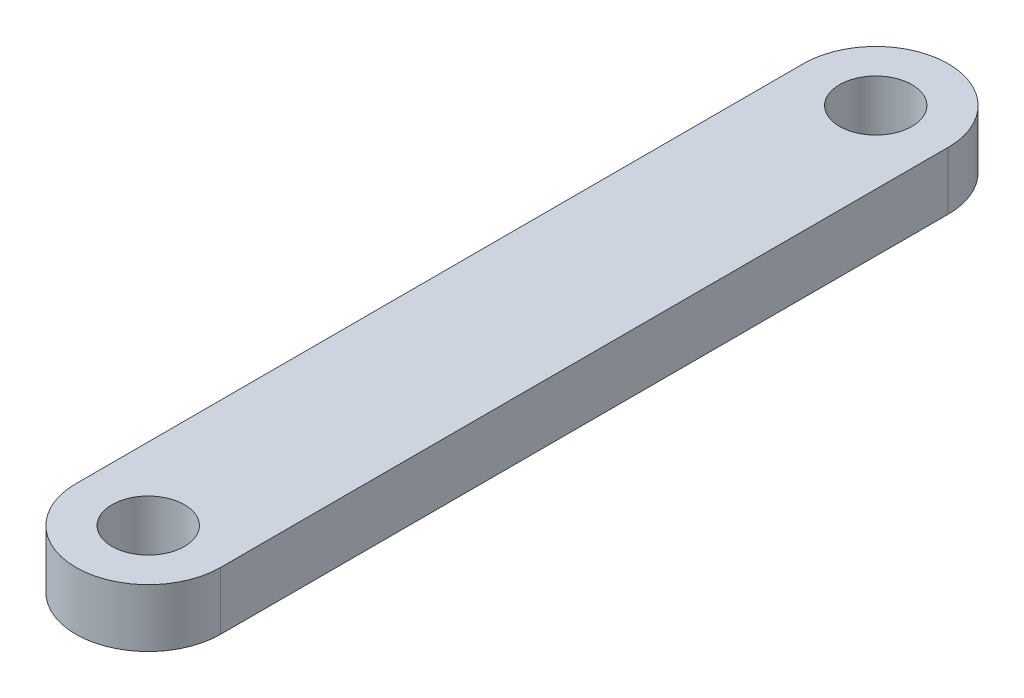
from build123d import *

# Parameters (mm, degrees)
SKETCH1_R           = 1
BOSS_EXTRUDE1_DEPTH = 2
MOVE_FACE1_BY       = 0.25
MOVE_FACE1_2_BY     = 0.25


with BuildPart() as part:
    # Sketch1 → Boss-Extrude1 (new body)
    with BuildSketch(Plane(origin=(0, 0, 0), x_dir=(1, 0, 0), z_dir=(0, 1, 0))):
        with BuildLine():
            Line((-2.5, 0), (-2.5, 25.11))
            ThreePointArc((-2.5, 25.11), (0, 27.61), (2.5, 25.11))
            Line((2.5, 25.11), (2.5, 0))
            ThreePointArc((2.5, 0), (0, -2.5), (-2.5, 0))
        make_face()
        with Locations(Location((0, 25.11, 0), (0, 0, 270))):
            Circle(SKETCH1_R, mode=Mode.SUBTRACT)
        with Locations(Location((0, 0, 0), (0, 0, 270))):
            Circle(SKETCH1_R, mode=Mode.SUBTRACT)
    extrude(amount=BOSS_EXTRUDE1_DEPTH)

    # Move Face1: a curved face moved inward by 0.25
    add(Solid.thicken(part.faces().sort_by_distance((0, 1, -26.11))[0], -MOVE_FACE1_BY), mode=Mode.SUBTRACT)

    # Move Face1 2: a curved face moved inward by 0.25
    add(Solid.thicken(part.faces().sort_by_distance((0, 1, -1))[0], -MOVE_FACE1_2_BY), mode=Mode.SUBTRACT)


solid = part.part
